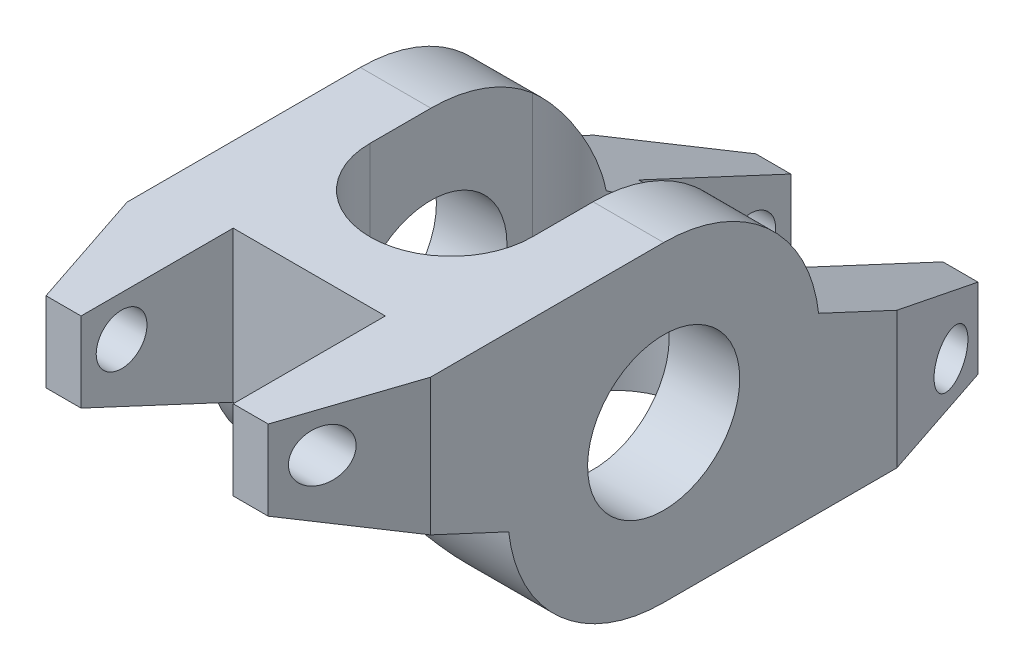
from build123d import *
from OCP.BRepFilletAPI import BRepFilletAPI_MakeChamfer

# Parameters (mm, degrees)
SKETCH1_R               = 4.765
BOSS_EXTRUDE1_DEPTH     = 9.5
CHAMFER1_SIZE           = 2.54
CHAMFER1_SIZE2          = 7.62
CHAMFER2_SIZE           = 7.62
CHAMFER2_SIZE2          = 2.54
CUT_EXTRUDE1_DEPTH      = 27.072555015
CUT_EXTRUDE1_DEPTH_BACK = 27.072555015
CUT_EXTRUDE2_DEPTH      = 27.072555089
CUT_EXTRUDE2_DEPTH_BACK = 27.072555089
SKETCH3_W               = 9.53
SKETCH3_H               = 9.53
CUT_EXTRUDE3_DEPTH      = 27.072555089
CUT_EXTRUDE3_DEPTH_BACK = 27.072555089
SKETCH4_R               = 1.59


with BuildPart() as part:
    # Sketch1 → Boss-Extrude1 (new, symmetric)
    with BuildSketch(Plane(origin=(0, 0, 0), x_dir=(0, 0, -1), z_dir=(1, 0, 0))):
        with BuildLine():
            Line((0, 9.765), (-22.23, 9.765))
            Line((-22.23, 9.765), (-22.23, 4.765))
            Line((-22.23, 4.765), (-9.705624325, -1.075212291))
            ThreePointArc((-9.705624325, -1.075212291), (-6.513669357, -7.275117629), (0, -9.765))
            Line((0, -9.765), (22.23, -9.765))
            Line((22.23, -9.765), (22.23, -4.765))
            Line((22.23, -4.765), (9.705624325, 1.075212291))
            ThreePointArc((9.705624325, 1.075212291), (6.513669357, 7.275117629), (0, 9.765))
        make_face()
        Circle(SKETCH1_R, mode=Mode.SUBTRACT)
    extrude(amount=BOSS_EXTRUDE1_DEPTH, both=True)

    # Chamfer1: one chamfer whose edges measure the first distance from different faces: ONE call of the kernel's chamfer builder (chamfer() names one face for all edges)
    chamfer1_edges_1 = [part.edges().sort_by_distance(p)[0] for p in [
        (9.5, -7.265, -22.23),
    ]]
    chamfer1_side_1 = [part.faces().sort_by_distance(p)[0] for p in [
        (0, -7.265, -22.23),
    ]]
    chamfer1_edges_2 = [part.edges().sort_by_distance(p)[0] for p in [
        (9.5, 7.265, 22.23),
    ]]
    chamfer1_side_2 = [part.faces().sort_by_distance(p)[0] for p in [
        (0, 7.265, 22.23),
    ]]
    chamfer1 = BRepFilletAPI_MakeChamfer(part.part.solid().wrapped)
    for e in chamfer1_edges_1:
        chamfer1.Add(CHAMFER1_SIZE, CHAMFER1_SIZE2, e.wrapped, chamfer1_side_1[0].wrapped)  # the first distance lies on this face
    for e in chamfer1_edges_2:
        chamfer1.Add(CHAMFER1_SIZE, CHAMFER1_SIZE2, e.wrapped, chamfer1_side_2[0].wrapped)  # the first distance lies on this face
    add(Compound.cast(chamfer1.Shape()), mode=Mode.REPLACE)

    # Chamfer2
    chamfer2_edges = [part.edges().sort_by_distance(p)[0] for p in [
        (-9.5, 7.265, 22.23),
        (-9.5, -7.265, -22.23),
    ]]
    chamfer2_side = [part.faces().sort_by_distance(p)[0] for p in [
        (-9.5, 9.279395995, 11.115),
    ]]
    chamfer(chamfer2_edges, length=CHAMFER2_SIZE, length2=CHAMFER2_SIZE2, reference=chamfer2_side[0])

    # Sketch2 → Cut-Extrude1 (cut, two sides: drawn at the far end of the back side and taken through both)
    with BuildSketch(Plane(origin=(0, 0, 0), x_dir=(1, 0, 0), z_dir=(0, 1, 0)).offset(-CUT_EXTRUDE1_DEPTH_BACK)):
        with BuildLine():
            Line((-5.08, -3.81), (-5.08, 6.35))
            ThreePointArc((-5.08, 6.35), (0, 11.43), (5.08, 6.35))
            Line((5.08, 6.35), (5.08, -3.81))
            ThreePointArc((5.08, -3.81), (0, -8.89), (-5.08, -3.81))
        make_face()
    extrude(amount=CUT_EXTRUDE1_DEPTH + CUT_EXTRUDE1_DEPTH_BACK, mode=Mode.SUBTRACT)

    # Sketch3 → Cut-Extrude2 (cut, two sides: drawn at the far end of the back side and taken through both)
    with BuildSketch(Plane(origin=(0, 0, 0), x_dir=(1, 0, 0), z_dir=(0, 1, 0)).offset(-CUT_EXTRUDE2_DEPTH_BACK)):
        with Locations((0, 17.465)):
            Rectangle(SKETCH3_W, SKETCH3_H)
        with Locations((0, -17.465)):
            Rectangle(SKETCH3_W, SKETCH3_H)
    extrude(amount=CUT_EXTRUDE2_DEPTH + CUT_EXTRUDE2_DEPTH_BACK, mode=Mode.SUBTRACT)

    # Sketch4 → Cut-Extrude3 (cut, two sides: drawn at the far end of the back side and taken through both)
    with BuildSketch(Plane(origin=(0, 0, 0), x_dir=(0, 0, -1), z_dir=(1, 0, 0)).offset(-CUT_EXTRUDE3_DEPTH_BACK)):
        with Locations(Location((-19.69, 7.225, 0), (0, 0, 180))):
            Circle(SKETCH4_R)
        with Locations((19.69, -7.225)):
            Circle(SKETCH4_R)
    extrude(amount=CUT_EXTRUDE3_DEPTH + CUT_EXTRUDE3_DEPTH_BACK, mode=Mode.SUBTRACT)


solid = part.part
